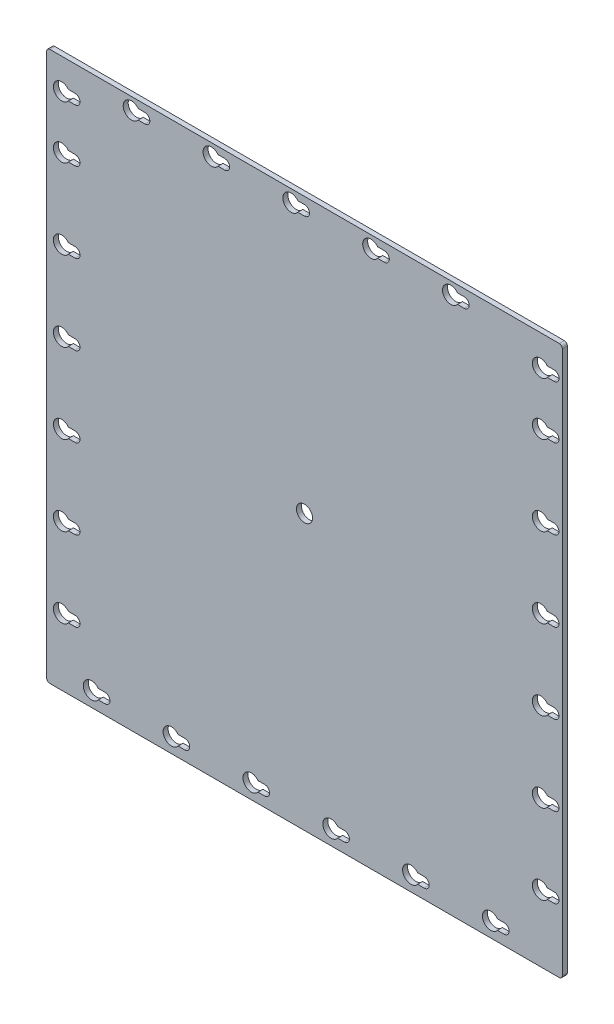
from build123d import *

# Parameters (mm, degrees)
SKETCH1_W           = 164.1
SKETCH1_H           = 174.745
SKETCH1_R           = 2.5527
BOSS_EXTRUDE1_DEPTH = 1.5875
FILLET1_R           = 1


with BuildPart() as part:
    # Sketch1 → Boss-Extrude1 (new body)
    with BuildSketch(Plane.XY):
        with Locations((82.55, -87.3725)):
            Rectangle(SKETCH1_W, SKETCH1_H)
        with Locations((82.55, -87.3725)):
            Circle(SKETCH1_R, mode=Mode.SUBTRACT)
        with BuildLine():
            Line((82.55, -5.4375), (80.434372699, -5.4375))
            ThreePointArc((80.434372699, -5.4375), (75.6625, -3.85), (80.434372699, -2.2625))
            Line((80.434372699, -2.2625), (82.55, -2.2625))
            ThreePointArc((82.55, -2.2625), (84.1375, -3.85), (82.55, -5.4375))
        make_face(mode=Mode.SUBTRACT)
        with BuildLine():
            Line((16.934372699, -168.395), (19.05, -168.395))
            ThreePointArc((19.05, -168.395), (20.6375, -169.9825), (19.05, -171.57))
            Line((19.05, -171.57), (16.934372699, -171.57))
            ThreePointArc((16.934372699, -171.57), (12.1625, -169.9825), (16.934372699, -168.395))
        make_face(mode=Mode.SUBTRACT)
        with BuildLine():
            Line((7.409372699, -151.9325), (9.525, -151.9325))
            ThreePointArc((9.525, -151.9325), (11.1125, -153.52), (9.525, -155.1075))
            Line((9.525, -155.1075), (7.409372699, -155.1075))
            ThreePointArc((7.409372699, -155.1075), (2.6375, -153.52), (7.409372699, -151.9325))
        make_face(mode=Mode.SUBTRACT)
        with BuildLine():
            Line((42.334372699, -168.395), (44.45, -168.395))
            ThreePointArc((44.45, -168.395), (46.0375, -169.9825), (44.45, -171.57))
            Line((44.45, -171.57), (42.334372699, -171.57))
            ThreePointArc((42.334372699, -171.57), (37.5625, -169.9825), (42.334372699, -168.395))
        make_face(mode=Mode.SUBTRACT)
        with BuildLine():
            Line((67.734372699, -168.395), (69.85, -168.395))
            ThreePointArc((69.85, -168.395), (71.4375, -169.9825), (69.85, -171.57))
            Line((69.85, -171.57), (67.734372699, -171.57))
            ThreePointArc((67.734372699, -171.57), (62.9625, -169.9825), (67.734372699, -168.395))
        make_face(mode=Mode.SUBTRACT)
        with BuildLine():
            Line((7.409372699, -126.5325), (9.525, -126.5325))
            ThreePointArc((9.525, -126.5325), (11.1125, -128.12), (9.525, -129.7075))
            Line((9.525, -129.7075), (7.409372699, -129.7075))
            ThreePointArc((7.409372699, -129.7075), (2.6375, -128.12), (7.409372699, -126.5325))
        make_face(mode=Mode.SUBTRACT)
        with BuildLine():
            Line((7.409372699, -101.1325), (9.525, -101.1325))
            ThreePointArc((9.525, -101.1325), (11.1125, -102.72), (9.525, -104.3075))
            Line((9.525, -104.3075), (7.409372699, -104.3075))
            ThreePointArc((7.409372699, -104.3075), (2.6375, -102.72), (7.409372699, -101.1325))
        make_face(mode=Mode.SUBTRACT)
        with BuildLine():
            Line((7.409372699, -75.7325), (9.525, -75.7325))
            ThreePointArc((9.525, -75.7325), (11.1125, -77.32), (9.525, -78.9075))
            Line((9.525, -78.9075), (7.409372699, -78.9075))
            ThreePointArc((7.409372699, -78.9075), (2.6375, -77.32), (7.409372699, -75.7325))
        make_face(mode=Mode.SUBTRACT)
        with BuildLine():
            Line((7.409372699, -50.3325), (9.525, -50.3325))
            ThreePointArc((9.525, -50.3325), (11.1125, -51.92), (9.525, -53.5075))
            Line((9.525, -53.5075), (7.409372699, -53.5075))
            ThreePointArc((7.409372699, -53.5075), (2.6375, -51.92), (7.409372699, -50.3325))
        make_face(mode=Mode.SUBTRACT)
        with BuildLine():
            Line((7.409372699, -24.9325), (9.525, -24.9325))
            ThreePointArc((9.525, -24.9325), (11.1125, -26.52), (9.525, -28.1075))
            Line((9.525, -28.1075), (7.409372699, -28.1075))
            ThreePointArc((7.409372699, -28.1075), (2.6375, -26.52), (7.409372699, -24.9325))
        make_face(mode=Mode.SUBTRACT)
        with BuildLine():
            Line((7.409372699, -8.1), (9.525, -8.1))
            ThreePointArc((9.525, -8.1), (11.1125, -9.6875), (9.525, -11.275))
            Line((9.525, -11.275), (7.409372699, -11.275))
            ThreePointArc((7.409372699, -11.275), (2.6375, -9.6875), (7.409372699, -8.1))
        make_face(mode=Mode.SUBTRACT)
        with BuildLine():
            Line((29.634372699, -2.2625), (31.75, -2.2625))
            ThreePointArc((31.75, -2.2625), (33.3375, -3.85), (31.75, -5.4375))
            Line((31.75, -5.4375), (29.634372699, -5.4375))
            ThreePointArc((29.634372699, -5.4375), (24.8625, -3.85), (29.634372699, -2.2625))
        make_face(mode=Mode.SUBTRACT)
        with BuildLine():
            Line((55.034372699, -2.2625), (57.15, -2.2625))
            ThreePointArc((57.15, -2.2625), (58.7375, -3.85), (57.15, -5.4375))
            Line((57.15, -5.4375), (55.034372699, -5.4375))
            ThreePointArc((55.034372699, -5.4375), (50.2625, -3.85), (55.034372699, -2.2625))
        make_face(mode=Mode.SUBTRACT)
        with BuildLine():
            ThreePointArc((161.925, -8.1), (163.5125, -9.6875), (161.925, -11.275))
            Line((161.925, -11.275), (159.809372699, -11.275))
            ThreePointArc((159.809372699, -11.275), (155.0375, -9.6875), (159.809372699, -8.1))
            Line((159.809372699, -8.1), (161.925, -8.1))
        make_face(mode=Mode.SUBTRACT)
        with BuildLine():
            Line((93.134372699, -168.395), (95.25, -168.395))
            ThreePointArc((95.25, -168.395), (96.8375, -169.9825), (95.25, -171.57))
            Line((95.25, -171.57), (93.134372699, -171.57))
            ThreePointArc((93.134372699, -171.57), (88.3625, -169.9825), (93.134372699, -168.395))
        make_face(mode=Mode.SUBTRACT)
        with BuildLine():
            Line((118.534372699, -168.395), (120.65, -168.395))
            ThreePointArc((120.65, -168.395), (122.2375, -169.9825), (120.65, -171.57))
            Line((120.65, -171.57), (118.534372699, -171.57))
            ThreePointArc((118.534372699, -171.57), (113.7625, -169.9825), (118.534372699, -168.395))
        make_face(mode=Mode.SUBTRACT)
        with BuildLine():
            Line((143.934372699, -168.395), (146.05, -168.395))
            ThreePointArc((146.05, -168.395), (147.6375, -169.9825), (146.05, -171.57))
            Line((146.05, -171.57), (143.934372699, -171.57))
            ThreePointArc((143.934372699, -171.57), (139.1625, -169.9825), (143.934372699, -168.395))
        make_face(mode=Mode.SUBTRACT)
        with BuildLine():
            Line((159.809372699, -151.9325), (161.925, -151.9325))
            ThreePointArc((161.925, -151.9325), (163.5125, -153.52), (161.925, -155.1075))
            Line((161.925, -155.1075), (159.809372699, -155.1075))
            ThreePointArc((159.809372699, -155.1075), (155.0375, -153.52), (159.809372699, -151.9325))
        make_face(mode=Mode.SUBTRACT)
        with BuildLine():
            Line((159.809372699, -126.5325), (161.925, -126.5325))
            ThreePointArc((161.925, -126.5325), (163.5125, -128.12), (161.925, -129.7075))
            Line((161.925, -129.7075), (159.809372699, -129.7075))
            ThreePointArc((159.809372699, -129.7075), (155.0375, -128.12), (159.809372699, -126.5325))
        make_face(mode=Mode.SUBTRACT)
        with BuildLine():
            Line((159.809372699, -101.1325), (161.925, -101.1325))
            ThreePointArc((161.925, -101.1325), (163.5125, -102.72), (161.925, -104.3075))
            Line((161.925, -104.3075), (159.809372699, -104.3075))
            ThreePointArc((159.809372699, -104.3075), (155.0375, -102.72), (159.809372699, -101.1325))
        make_face(mode=Mode.SUBTRACT)
        with BuildLine():
            Line((159.809372699, -75.7325), (161.925, -75.7325))
            ThreePointArc((161.925, -75.7325), (163.5125, -77.32), (161.925, -78.9075))
            Line((161.925, -78.9075), (159.809372699, -78.9075))
            ThreePointArc((159.809372699, -78.9075), (155.0375, -77.32), (159.809372699, -75.7325))
        make_face(mode=Mode.SUBTRACT)
        with BuildLine():
            Line((159.809372699, -50.3325), (161.925, -50.3325))
            ThreePointArc((161.925, -50.3325), (163.5125, -51.92), (161.925, -53.5075))
            Line((161.925, -53.5075), (159.809372699, -53.5075))
            ThreePointArc((159.809372699, -53.5075), (155.0375, -51.92), (159.809372699, -50.3325))
        make_face(mode=Mode.SUBTRACT)
        with BuildLine():
            Line((105.834372699, -2.2625), (107.95, -2.2625))
            ThreePointArc((107.95, -2.2625), (109.5375, -3.85), (107.95, -5.4375))
            Line((107.95, -5.4375), (105.834372699, -5.4375))
            ThreePointArc((105.834372699, -5.4375), (101.0625, -3.85), (105.834372699, -2.2625))
        make_face(mode=Mode.SUBTRACT)
        with BuildLine():
            Line((159.809372699, -24.9325), (161.925, -24.9325))
            ThreePointArc((161.925, -24.9325), (163.5125, -26.52), (161.925, -28.1075))
            Line((161.925, -28.1075), (159.809372699, -28.1075))
            ThreePointArc((159.809372699, -28.1075), (155.0375, -26.52), (159.809372699, -24.9325))
        make_face(mode=Mode.SUBTRACT)
        with BuildLine():
            Line((131.234372699, -2.2625), (133.35, -2.2625))
            ThreePointArc((133.35, -2.2625), (134.9375, -3.85), (133.35, -5.4375))
            Line((133.35, -5.4375), (131.234372699, -5.4375))
            ThreePointArc((131.234372699, -5.4375), (126.4625, -3.85), (131.234372699, -2.2625))
        make_face(mode=Mode.SUBTRACT)
    extrude(amount=BOSS_EXTRUDE1_DEPTH)

    # Fillet1
    fillet1_edges = [part.edges().sort_by_distance(p)[0] for p in [
        (0.5, -174.745, 0.79375),
        (0.5, 0, 0.79375),
        (164.6, 0, 0.79375),
        (164.6, -174.745, 0.79375),
    ]]
    fillet(fillet1_edges, radius=FILLET1_R)


solid = part.part
